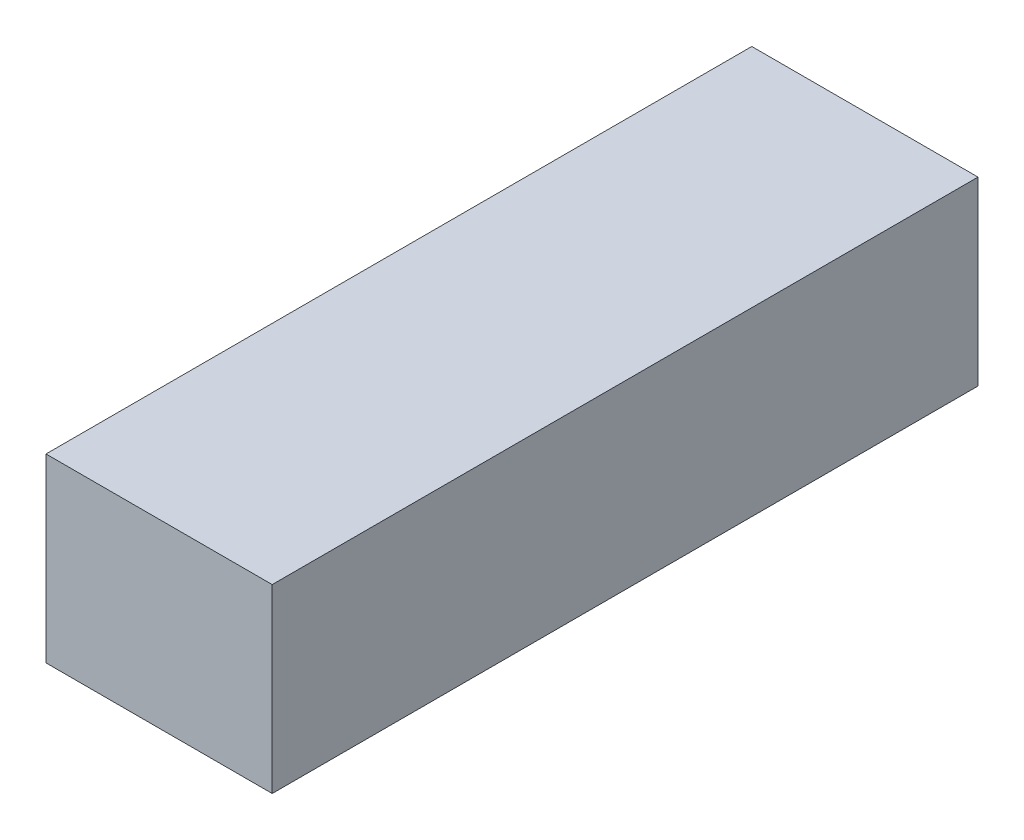
from build123d import *

# Parameters (mm, degrees)
SKETCH1_W           = 25
SKETCH1_H           = 20
BOSS_EXTRUDE2_DEPTH = 78


with BuildPart() as part:
    # Sketch1 → Boss-Extrude2 (new body)
    with BuildSketch(Plane.XY):
        with Locations((12.5, -10)):
            Rectangle(SKETCH1_W, SKETCH1_H)
    extrude(amount=BOSS_EXTRUDE2_DEPTH)


solid = part.part
